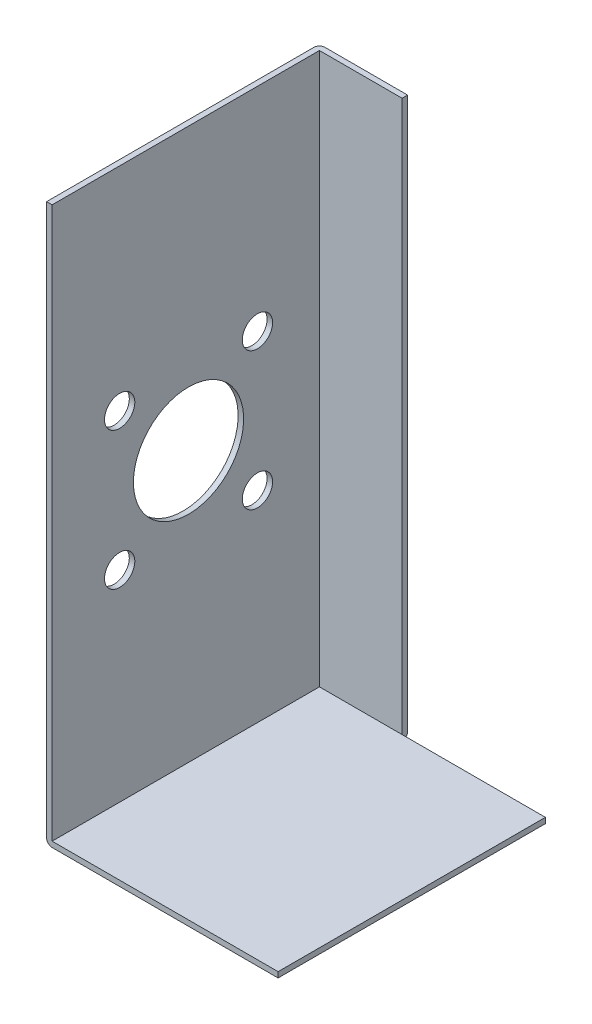
from build123d import *

# Parameters (mm, degrees)
SKETCH1_W           = 99
SKETCH1_H           = 202
BOSS_EXTRUDE1_DEPTH = 2
SKETCH2_W           = 97
SKETCH2_H           = 2
BOSS_EXTRUDE2_DEPTH = 82
SKETCH3_W           = 2
SKETCH3_H           = 202
BOSS_EXTRUDE3_DEPTH = 30
FILLET1_R           = 2
SKETCH5_R           = 20
SKETCH5_R_2         = 5.5
CUT_EXTRUDE1_DEPTH  = 41


with BuildPart() as part:
    # Sketch1 → Boss-Extrude1 (new body)
    with BuildSketch(Plane(origin=(0, 0, 0), x_dir=(0, 0, -1), z_dir=(1, 0, 0))):
        with Locations((49.5, 101)):
            Rectangle(SKETCH1_W, SKETCH1_H)
    extrude(amount=BOSS_EXTRUDE1_DEPTH)

    # Sketch2 → Boss-Extrude2 (add)
    with BuildSketch(Plane(origin=(2, 0, 0), x_dir=(0, 0, -1), z_dir=(1, 0, 0))):
        with Locations((48.5, 1)):
            Rectangle(SKETCH2_W, SKETCH2_H)
    extrude(amount=BOSS_EXTRUDE2_DEPTH)

    # Sketch3 → Boss-Extrude3 (add)
    with BuildSketch(Plane(origin=(2, 0, 0), x_dir=(0, 0, -1), z_dir=(1, 0, 0))):
        with Locations((98, 101)):
            Rectangle(SKETCH3_W, SKETCH3_H)
    extrude(amount=BOSS_EXTRUDE3_DEPTH)

    # Fillet1
    fillet1_edges = [part.edges().sort_by_distance(p)[0] for p in [
        (16, 0, -99),
        (0, 0, -49.5),
        (0, 101, -99),
    ]]
    fillet(fillet1_edges, radius=FILLET1_R)

    # Sketch5 → Cut-Extrude1 (cut)
    with BuildSketch(Plane.ZY):
        with Locations((-49.5, 100)):
            Circle(SKETCH5_R)
        with Locations((-24.5, 125)):
            Circle(SKETCH5_R_2)
        with Locations((-74.5, 125)):
            Circle(SKETCH5_R_2)
        with Locations((-24.5, 75)):
            Circle(SKETCH5_R_2)
        with Locations((-74.5, 75)):
            Circle(SKETCH5_R_2)
    extrude(amount=-CUT_EXTRUDE1_DEPTH, mode=Mode.SUBTRACT)


solid = part.part
